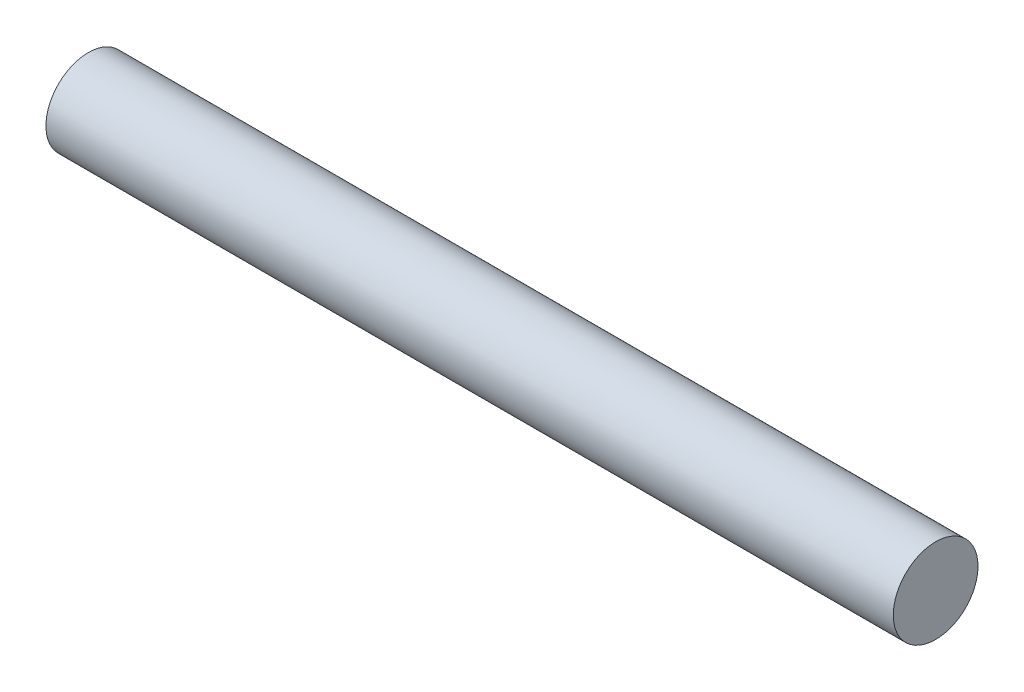
from build123d import *

# Parameters (mm, degrees)
SKETCH1_R           = 50
BOSS_EXTRUDE1_DEPTH = 1000


with BuildPart() as part:
    # Sketch1 → Boss-Extrude1 (new body)
    with BuildSketch(Plane(origin=(0, 0, 0), x_dir=(0, 0, -1), z_dir=(1, 0, 0))):
        Circle(SKETCH1_R)
    extrude(amount=BOSS_EXTRUDE1_DEPTH)


solid = part.part
